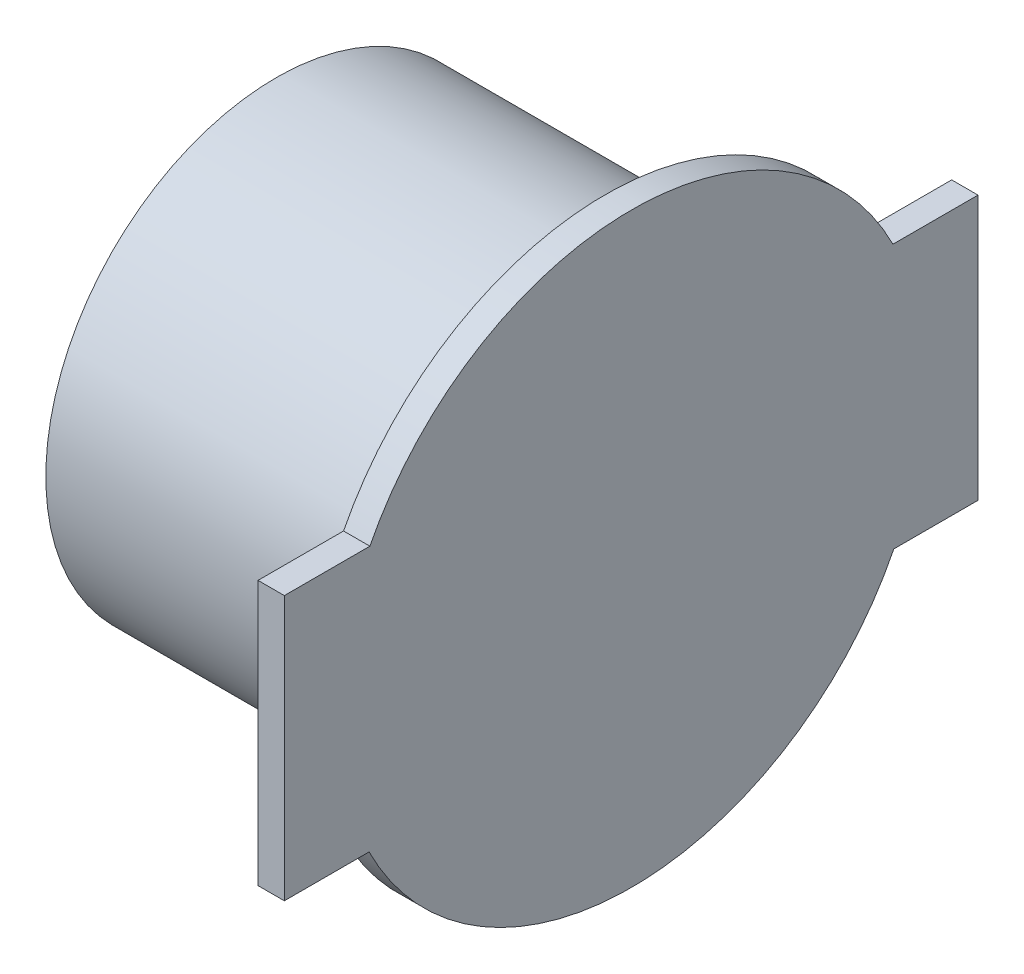
from build123d import *

# Parameters (mm, degrees)
SKETCH_2_R      = 17.5
EXTRUDE_1_DEPTH = 25
EXTRUDE_2_DEPTH = 2


with BuildPart() as part:
    # 草图2 → 凸台-拉伸1 (new body)
    with BuildSketch(Plane(origin=(0, 0, 0), x_dir=(0, 0, -1), z_dir=(1, 0, 0))):
        Circle(SKETCH_2_R)
    extrude(amount=EXTRUDE_1_DEPTH)

    # 草图3 → 凸台-拉伸2 (add)
    with BuildSketch(Plane(origin=(25, 0, 0), x_dir=(0, 0, -1), z_dir=(1, 0, 0))):
        with BuildLine():
            Line((-22.296317142, 10.105406997), (-19.874770628, 10.105406997))
            ThreePointArc((-19.874770628, 10.105406997), (0, 22.296317142), (19.874770628, 10.105406997))
            Line((19.874770628, 10.105406997), (22.296317142, 10.105406997))
            Line((22.296317142, 10.105406997), (26.334302173, 10.105406997))
            Line((26.334302173, 10.105406997), (26.334302173, 0))
            Line((26.334302173, 0), (26.334302173, -9.98295184))
            Line((26.334302173, -9.98295184), (22.296317142, -9.98295184))
            Line((22.296317142, -9.98295184), (19.936560151, -9.98295184))
            ThreePointArc((19.936560151, -9.98295184), (0, -22.296317142), (-19.936560151, -9.98295184))
            Line((-19.936560151, -9.98295184), (-22.296317142, -9.98295184))
            Line((-22.296317142, -9.98295184), (-26.374870703, -9.98295184))
            Line((-26.374870703, -9.98295184), (-26.374870703, 0))
            Line((-26.374870703, 0), (-26.374870703, 10.105406997))
            Line((-26.374870703, 10.105406997), (-22.296317142, 10.105406997))
        make_face()
    extrude(amount=EXTRUDE_2_DEPTH)


solid = part.part
